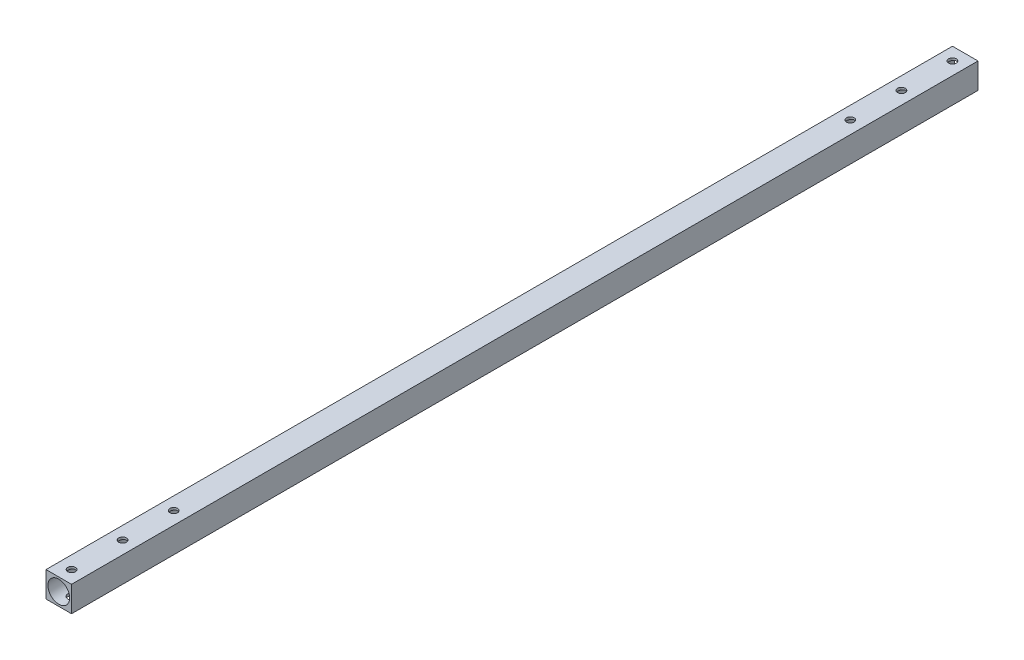
from build123d import *

# Parameters (mm, degrees)
SKETCH1_W           = 10
SKETCH1_H           = 10
SKETCH1_R           = 4.25
BOSS_EXTRUDE1_DEPTH = 355
SKETCH2_R           = 1.5
CUT_EXTRUDE1_DEPTH  = 356.176012704


with BuildPart() as part:
    # Sketch1 → Boss-Extrude1 (new body)
    with BuildSketch(Plane.XY):
        Rectangle(SKETCH1_W, SKETCH1_H)
        Circle(SKETCH1_R, mode=Mode.SUBTRACT)
    extrude(amount=BOSS_EXTRUDE1_DEPTH)

    # Sketch2 → Cut-Extrude1 (cut, through all)
    with BuildSketch(Plane(origin=(0, 5, 0), x_dir=(1, 0, 0), z_dir=(0, 1, 0))):
        with Locations(Location((0, -5, 0), (0, 0, 270))):
            Circle(SKETCH2_R)
        with Locations(Location((0, -25, 0), (0, 0, 270))):
            Circle(SKETCH2_R)
        with Locations(Location((0, -45, 0), (0, 0, 270))):
            Circle(SKETCH2_R)
        with Locations(Location((0, -350, 0), (0, 0, 270))):
            Circle(SKETCH2_R)
        with Locations(Location((0, -330, 0), (0, 0, 270))):
            Circle(SKETCH2_R)
        with Locations(Location((0, -310, 0), (0, 0, 270))):
            Circle(SKETCH2_R)
    extrude(amount=-CUT_EXTRUDE1_DEPTH, mode=Mode.SUBTRACT)


solid = part.part
